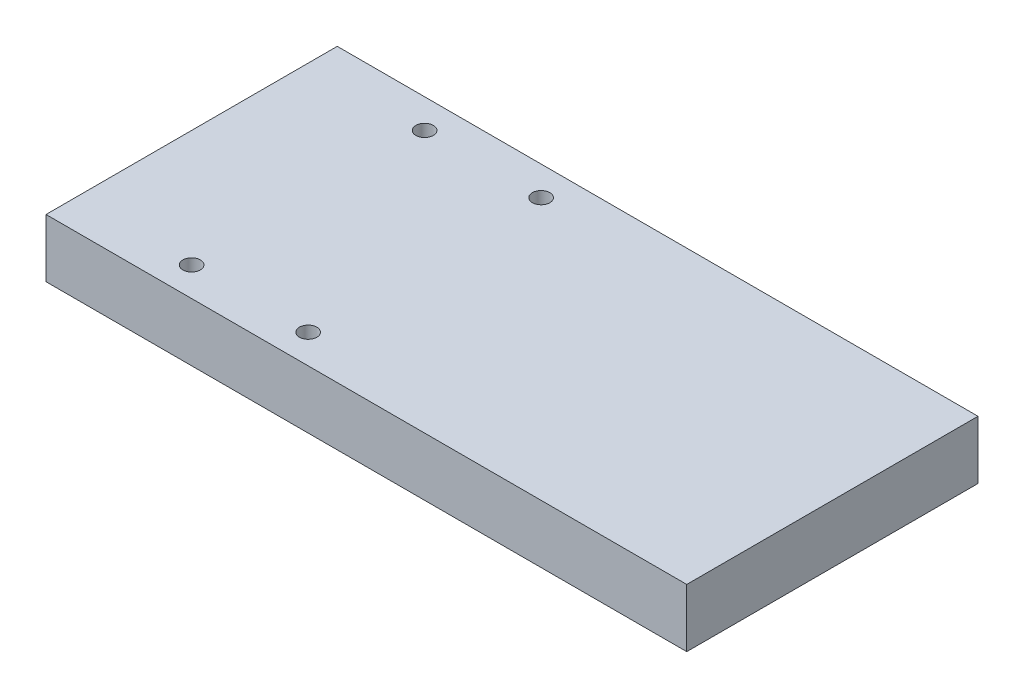
from build123d import *

# Parameters (mm, degrees)
SKETCH_1_W          = 220
SKETCH_1_H          = 100
EXTRUDE_1_DEPTH     = 20
SKETCH_3_R          = 3
CUT_EXTRUDE_2_DEPTH = 20


with BuildPart() as part:
    # Эскиз1 → Бобышка-Вытянуть1 (new body)
    with BuildSketch(Plane(origin=(0, 0, 0), x_dir=(1, 0, 0), z_dir=(0, 1, 0))):
        with Locations((110, 50)):
            Rectangle(SKETCH_1_W, SKETCH_1_H)
    extrude(amount=EXTRUDE_1_DEPTH)

    # Эскиз3 → Вырез-Вытянуть2 (cut)
    with BuildSketch(Plane(origin=(0, 20, 0), x_dir=(1, 0, 0), z_dir=(0, 1, 0))):
        with Locations(Location((40, 90, 0), (0, 0, 270))):
            Circle(SKETCH_3_R)
        with Locations(Location((80, 90, 0), (0, 0, 270))):
            Circle(SKETCH_3_R)
        with Locations(Location((40, 10, 0), (0, 0, 270))):
            Circle(SKETCH_3_R)
        with Locations(Location((80, 10, 0), (0, 0, 270))):
            Circle(SKETCH_3_R)
    extrude(amount=-CUT_EXTRUDE_2_DEPTH, mode=Mode.SUBTRACT)


solid = part.part
